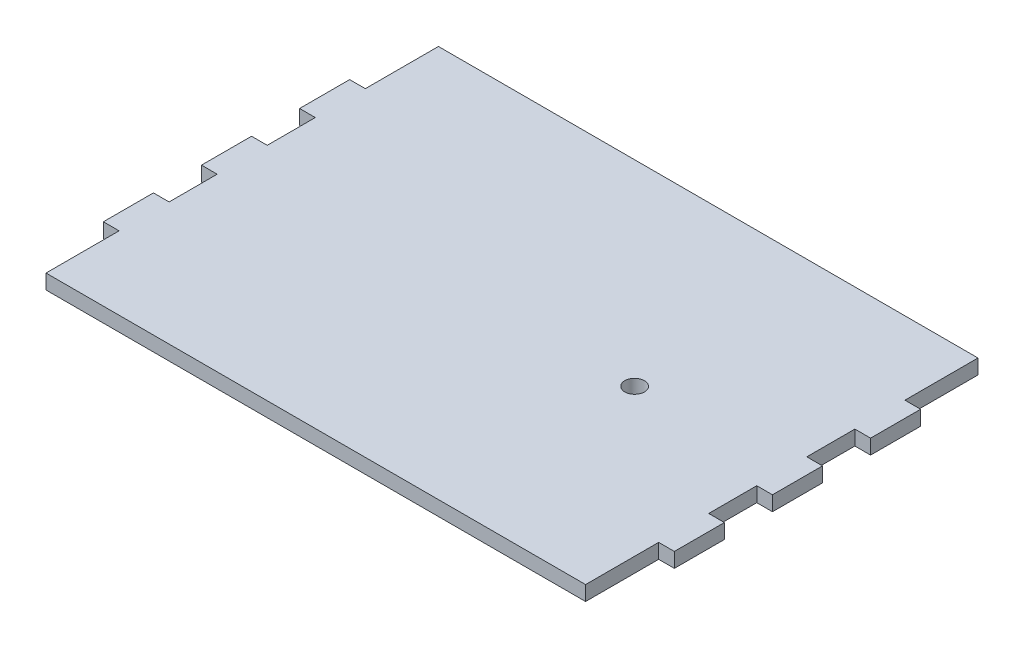
from build123d import *

# Parameters (mm, degrees)
CROQUIS1_R              = 2
SALIENTE_EXTRUIR1_DEPTH = 3


with BuildPart() as part:
    # Croquis1 → Saliente-Extruir1 (new body)
    with BuildSketch(Plane(origin=(0, 0, 0), x_dir=(1, 0, 0), z_dir=(0, 1, 0))):
        Polygon((55, 14.9), (55, 5.1), (58.2, 5.1), (58.2, -5.1), (55, -5.1), (55, -14.9), (58.2, -14.9), (58.2, -25.1), (55, -25.1), (55, -40), (-55, -40), (-55, -25.1), (-58.2, -25.1), (-58.2, -14.9), (-55, -14.9), (-55, -5.1), (-58.2, -5.1), (-58.2, 5.1), (-55, 5.1), (-55, 14.9), (-58.2, 14.9), (-58.2, 25.1), (-55, 25.1), (-55, 40), (55, 40), (55, 25.1), (58.2, 25.1), (58.2, 14.9), align=None)
        with Locations(Location((25, 0, 0), (0, 0, 270))):
            Circle(CROQUIS1_R, mode=Mode.SUBTRACT)
    extrude(amount=SALIENTE_EXTRUIR1_DEPTH)


solid = part.part
